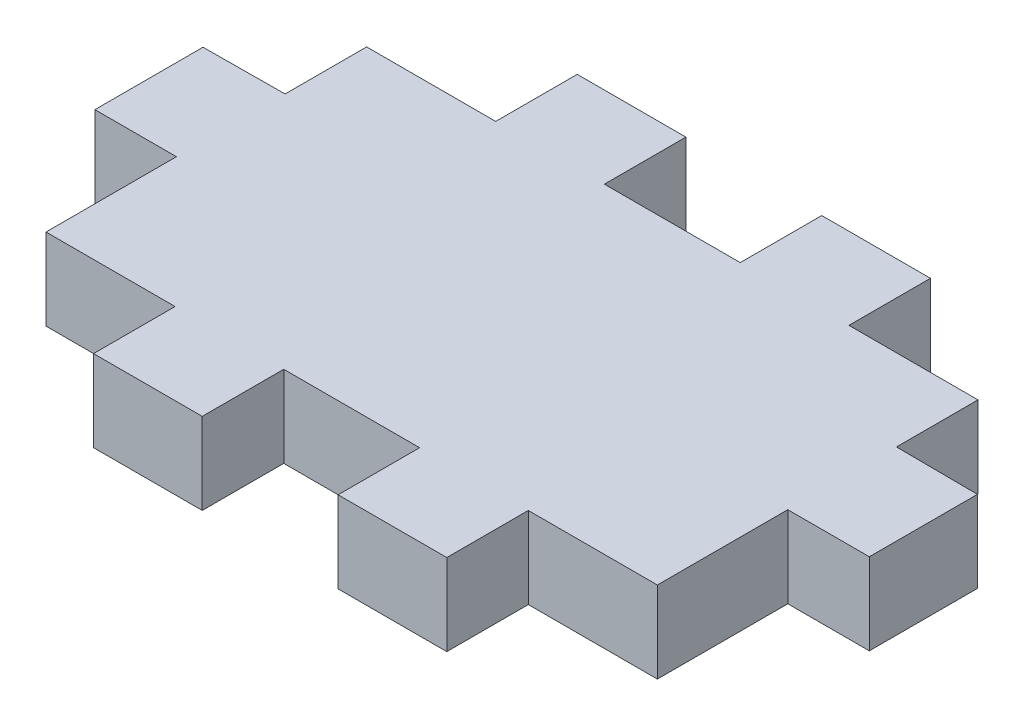
from build123d import *

# Parameters (mm, degrees)
SKETCH1_W           = 30
SKETCH1_H           = 50
BOSS_EXTRUDE1_DEPTH = 3
SKETCH2_W           = 7.75
SKETCH2_H           = 3
SKETCH2_W_2         = 5
CUT_EXTRUDE1_DEPTH  = 10
CUT_EXTRUDE2_DEPTH  = 10
SKETCH4_W           = 7.75
SKETCH4_H           = 3
SKETCH4_W_2         = 5
CUT_EXTRUDE3_DEPTH  = 10
CUT_EXTRUDE4_DEPTH  = 3


with BuildPart() as part:
    # Sketch1 → Boss-Extrude1 (new body)
    with BuildSketch(Plane(origin=(0, 0, 0), x_dir=(1, 0, 0), z_dir=(0, 1, 0))):
        Rectangle(SKETCH1_W, SKETCH1_H)
    extrude(amount=BOSS_EXTRUDE1_DEPTH)

    # Sketch2 → Cut-Extrude1 (cut)
    with BuildSketch(Plane(origin=(0, 3, 0), x_dir=(1, 0, 0), z_dir=(0, 1, 0))):
        with Locations((11.125, 23.5)):
            Rectangle(SKETCH2_W, SKETCH2_H)
        with Locations((0.75, 23.5)):
            Rectangle(SKETCH2_W_2, SKETCH2_H)
        with Locations((-9.625, 23.5)):
            Rectangle(SKETCH2_W, SKETCH2_H)
    extrude(amount=-CUT_EXTRUDE1_DEPTH, mode=Mode.SUBTRACT)

    # Sketch3 → Cut-Extrude2 (cut)
    with BuildSketch(Plane(origin=(0, 3, 0), x_dir=(1, 0, 0), z_dir=(0, 1, 0))):
        Polygon((-13.5, 22), (-13.5, 7.2), (33.838871071, 7.2), (23.912216497, -42.141377109), (-28.226414581, -62.151393572), (-28.226414581, 29.547983922), (-12.54526701, 26.393200971), align=None)
    extrude(amount=-CUT_EXTRUDE2_DEPTH, mode=Mode.SUBTRACT)

    # Sketch4 → Cut-Extrude3 (cut)
    with BuildSketch(Plane(origin=(0, 3, 0), x_dir=(1, 0, 0), z_dir=(0, 1, 0))):
        with Locations((11.125, 8.7)):
            Rectangle(SKETCH4_W, SKETCH4_H)
        with Locations((-9.625, 8.7)):
            Rectangle(SKETCH4_W, SKETCH4_H)
        with Locations((0.75, 8.7)):
            Rectangle(SKETCH4_W_2, SKETCH4_H)
    extrude(amount=-CUT_EXTRUDE3_DEPTH, mode=Mode.SUBTRACT)

    # Sketch5 → Cut-Extrude4 (cut)
    with BuildSketch(Plane(origin=(0, 3, 0), x_dir=(1, 0, 0), z_dir=(0, 1, 0))):
        Polygon((-10.5, 10.2), (-10.5, 15), (-13.5, 15), (-13.5, 18.977632451), (-10.5, 19), (-10.5, 22), (-14.44173644, 22), (-14.44173644, 10.2), align=None)
        Polygon((15.94173644, 22), (15.94173644, 10.2), (12, 10.2), (12, 15), (15, 15), (15, 18.977632451), (12, 19), (12, 22), align=None)
    extrude(amount=-CUT_EXTRUDE4_DEPTH, mode=Mode.SUBTRACT)


solid = part.part
